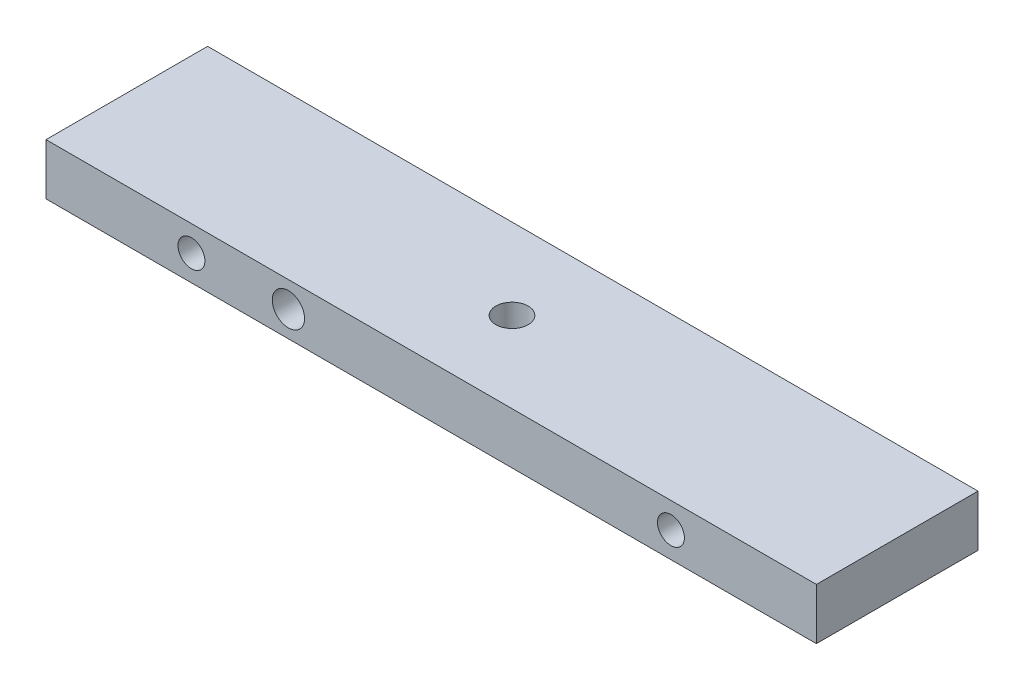
from build123d import *

# Parameters (mm, degrees)
ESBO_O1_W                = 50
ESBO_O1_H                = 9.53
RESSALTO_EXTRUS_O1_DEPTH = 30
ESBO_O2_R                = 3
CORTE_EXTRUS_O1_DEPTH    = 40.340884904
ESBO_O4_W                = 30
ESBO_O4_H                = 9.53
RESSALTO_EXTRUS_O3_DEPTH = 60.01
ESBO_O5_W                = 30
ESBO_O5_H                = 9.53
RESSALTO_EXTRUS_O4_DEPTH = 33
ESBO_O6_R                = 2.5
CORTE_EXTRUS_O2_DEPTH    = 10
CORTE_EXTRUS_O3_REACH    = 92.651
ESBO_O7_R                = 3


with BuildPart() as part:
    # Esboço1 → Ressalto-extrusão1 (new body)
    with BuildSketch(Plane.XY):
        Rectangle(ESBO_O1_W, ESBO_O1_H)
    extrude(amount=RESSALTO_EXTRUS_O1_DEPTH)

    # Esboço2 → Corte-extrusão1 (cut, through all)
    with BuildSketch(Plane.XY.offset(30)):
        with Locations((-13, 0)):
            Circle(ESBO_O2_R)
    extrude(amount=-CORTE_EXTRUS_O1_DEPTH, mode=Mode.SUBTRACT)

    # Esboço4 → Ressalto-extrusão3 (add)
    with BuildSketch(Plane(origin=(25, 0, 0), x_dir=(0, 0, -1), z_dir=(1, 0, 0))):
        with Locations((-15, 0)):
            Rectangle(ESBO_O4_W, ESBO_O4_H)
    extrude(amount=RESSALTO_EXTRUS_O3_DEPTH)

    # Esboço5 → Ressalto-extrusão4 (add)
    with BuildSketch(Plane.ZY.offset(25)):
        with Locations((15, 0)):
            Rectangle(ESBO_O5_W, ESBO_O5_H)
    extrude(amount=RESSALTO_EXTRUS_O4_DEPTH)

    # Esboço6 → Corte-extrusão2 (cut)
    with BuildSketch(Plane.XY.offset(30)):
        with Locations((-31, 0)):
            Circle(ESBO_O6_R)
        with Locations((58.01, 0)):
            Circle(ESBO_O6_R)
    extrude(amount=-CORTE_EXTRUS_O2_DEPTH, mode=Mode.SUBTRACT)

    # Esboço7 → Corte-extrusão3 (cut, up to next)
    with BuildSketch(Plane(origin=(0, 4.765, 0), x_dir=(1, 0, 0), z_dir=(0, 1, 0)), mode=Mode.PRIVATE) as corte_extrus_o3_sk1:
        with Locations(Location((13.505, -15, 0), (0, 0, 270))):
            Circle(ESBO_O7_R)
    corte_extrus_o3_tool1 = extrude(corte_extrus_o3_sk1.sketch, amount=-CORTE_EXTRUS_O3_REACH, mode=Mode.PRIVATE) & part.part
    add(corte_extrus_o3_tool1.solids().sort_by_distance((13.505, 4.765, 15))[0], mode=Mode.SUBTRACT)


solid = part.part
